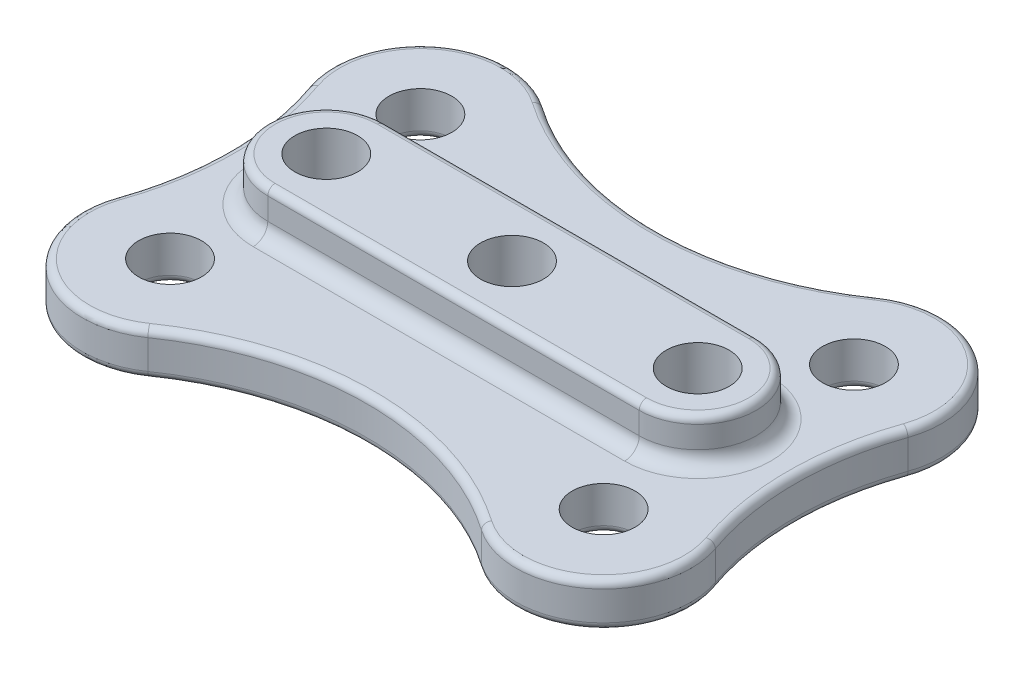
from build123d import *

# Parameters (mm, degrees)
SKETCH1_R           = 2.15
BOSS_EXTRUDE1_DEPTH = 3
FILLET1_R           = 20
SKETCH2_R           = 2.15
BOSS_EXTRUDE2_DEPTH = 3
FILLET2_R           = 0.5
FILLET3_R           = 1


with BuildPart() as part:
    # Sketch1 → Boss-Extrude1 (new body)
    with BuildSketch(Plane(origin=(0, 0, 0), x_dir=(1, 0, 0), z_dir=(0, 1, 0))):
        with BuildLine():
            Line((-11.238128062, 13.369090052), (0, 4.989544408))
            Line((0, 4.989544408), (11.238128062, 13.369090052))
            ThreePointArc((11.238128062, 13.369090052), (18.695012917, 13.143844096), (20.168373744, 5.830494975))
            Line((20.168373744, 5.830494975), (17.191273403, 0))
            Line((17.191273403, 0), (20.168373744, -5.830494975))
            ThreePointArc((20.168373744, -5.830494975), (18.695012917, -13.143844096), (11.238128062, -13.369090052))
            Line((11.238128062, -13.369090052), (0, -4.989544408))
            Line((0, -4.989544408), (-11.238128062, -13.369090052))
            ThreePointArc((-11.238128062, -13.369090052), (-18.695012917, -13.143844096), (-20.168373744, -5.830494975))
            Line((-20.168373744, -5.830494975), (-17.191273403, 0))
            Line((-17.191273403, 0), (-20.168373744, 5.830494975))
            ThreePointArc((-20.168373744, 5.830494975), (-18.695012917, 13.143844096), (-11.238128062, 13.369090052))
        make_face()
        with Locations(Location((0, 0, 0), (0, 0, 270))):
            Circle(SKETCH1_R, mode=Mode.SUBTRACT)
        with Locations(Location((14.824677681, 8.55903165, 0), (0, 0, 270))):
            Circle(SKETCH1_R, mode=Mode.SUBTRACT)
        with Locations(Location((14.824677681, -8.55903165, 0), (0, 0, 270))):
            Circle(SKETCH1_R, mode=Mode.SUBTRACT)
        with Locations(Location((-14.824677681, -8.55903165, 0), (0, 0, 270))):
            Circle(SKETCH1_R, mode=Mode.SUBTRACT)
        with Locations(Location((-14.824677681, 8.55903165, 0), (0, 0, 270))):
            Circle(SKETCH1_R, mode=Mode.SUBTRACT)
        with Locations(Location((12.7, 0, 0), (0, 0, 270))):
            Circle(SKETCH1_R, mode=Mode.SUBTRACT)
        with Locations(Location((-12.7, 0, 0), (0, 0, 270))):
            Circle(SKETCH1_R, mode=Mode.SUBTRACT)
    extrude(amount=BOSS_EXTRUDE1_DEPTH)

    # Fillet1
    fillet1_edges = [part.edges().sort_by_distance(p)[0] for p in [
        (17.191273403, 1.5, 0),
        (-17.191273403, 1.5, 0),
        (0, 1.5, 4.989544408),
        (0, 1.5, -4.989544408),
    ]]
    fillet(fillet1_edges, radius=FILLET1_R)

    # Sketch2 → Boss-Extrude2 (add)
    with BuildSketch(Plane(origin=(0, 3, 0), x_dir=(1, 0, 0), z_dir=(0, 1, 0))):
        with BuildLine():
            Line((-12.7, 4), (12.7, 4))
            ThreePointArc((12.7, 4), (16.7, 0), (12.7, -4))
            Line((12.7, -4), (-12.7, -4))
            ThreePointArc((-12.7, -4), (-16.7, 0), (-12.7, 4))
        make_face()
        with Locations(Location((12.7, 0, 0), (0, 0, 270))):
            Circle(SKETCH2_R, mode=Mode.SUBTRACT)
        with Locations(Location((0, 0, 0), (0, 0, 270))):
            Circle(SKETCH2_R, mode=Mode.SUBTRACT)
        with Locations(Location((-12.7, 0, 0), (0, 0, 270))):
            Circle(SKETCH2_R, mode=Mode.SUBTRACT)
    extrude(amount=BOSS_EXTRUDE2_DEPTH)

    # Fillet2
    fillet2_edges = [part.edges().sort_by_distance(p)[0] for p in [
        (0, 0, -2.15),
        (12.7, 0, -2.15),
        (14.824677681, 0, -10.70903165),
        (14.824677681, 0, 6.40903165),
        (-14.824677681, 0, 6.40903165),
        (-14.824677681, 0, -10.70903165),
        (-12.7, 0, -2.15),
        (18.454651703, 0, -13.336404213),
        (18.454651703, 3, -13.336404213),
        (18.454651703, 0, 13.336404213),
        (18.454651703, 3, 13.336404213),
        (-18.454651703, 0, 13.336404213),
        (-18.454651703, 3, 13.336404213),
        (-18.454651703, 0, -13.336404213),
        (-18.454651703, 3, -13.336404213),
        (19.375502051, 0, 0),
        (19.375502051, 3, 0),
        (-19.375502051, 0, 0),
        (-19.375502051, 3, 0),
        (0, 0, 9.918547835),
        (0, 3, 9.918547835),
        (0, 0, -9.918547835),
        (0, 3, -9.918547835),
        (0, 6, -4),
        (0, 6, 4),
        (16.7, 6, 0),
        (-16.7, 6, 0),
    ]]
    fillet(fillet2_edges, radius=FILLET2_R)

    # Fillet3
    fillet3_edges = [part.edges().sort_by_distance(p)[0] for p in [
        (0, 3, 4),
        (16.7, 3, 0),
        (-16.7, 3, 0),
        (0, 3, -4),
    ]]
    fillet(fillet3_edges, radius=FILLET3_R)


solid = part.part
